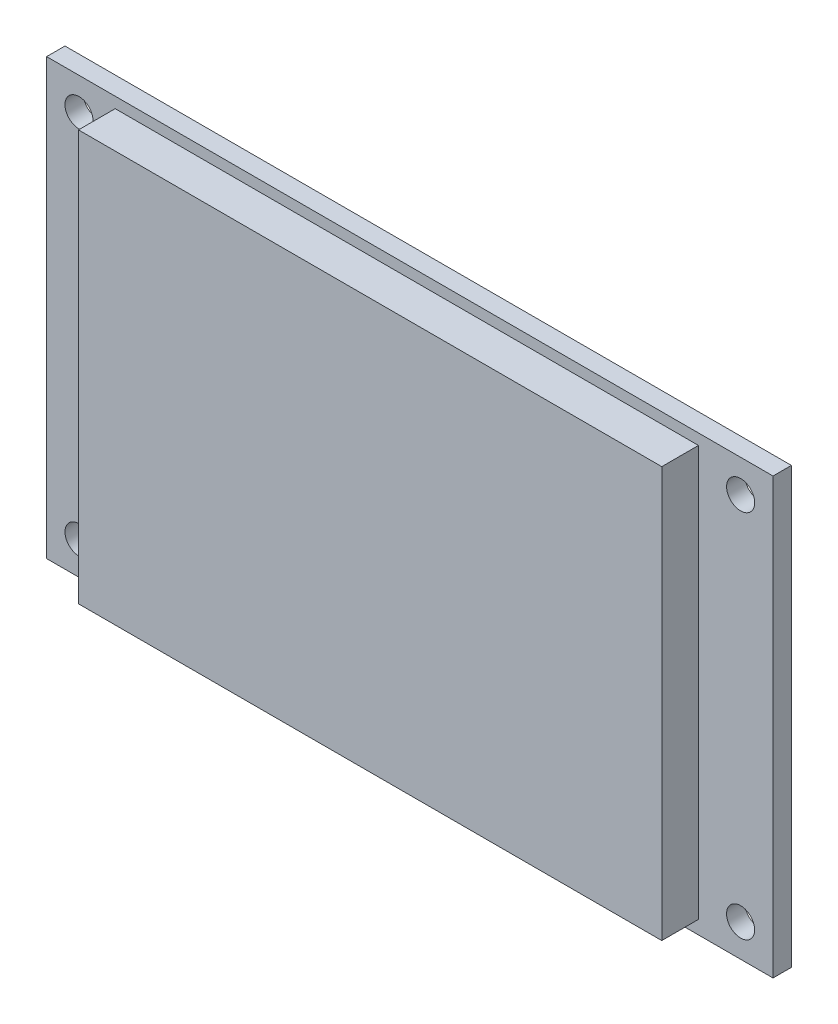
from build123d import *

# Parameters (mm, degrees)
SKETCH_1_W        = 67.25
SKETCH_1_H        = 40.25
EXTRUDE_1_DEPTH   = 1.7
SKETCH_2_W        = 54
SKETCH_2_H        = 38
EXTRUDE_2_DEPTH   = 3.4
HOLE_WIZARD_M21_D = 2.6


with BuildPart() as part:
    # Эскиз1 → Бобышка-Вытянуть1 (new body)
    with BuildSketch(Plane.XY):
        Rectangle(SKETCH_1_W, SKETCH_1_H)
    extrude(amount=EXTRUDE_1_DEPTH)

    # Эскиз2 → Бобышка-Вытянуть2 (add)
    with BuildSketch(Plane.XY.offset(1.7)):
        with Locations((-0.275, 0.125)):
            Rectangle(SKETCH_2_W, SKETCH_2_H)
    extrude(amount=EXTRUDE_2_DEPTH)

    # Отверстие с зазором M21 (through all)
    with Locations(Plane.XY.offset(1.7)):
        with Locations((-30.625, 17.125), (-30.625, -17.125), (30.625, -17.125), (30.625, 17.125)):
            Hole(HOLE_WIZARD_M21_D / 2)


solid = part.part
